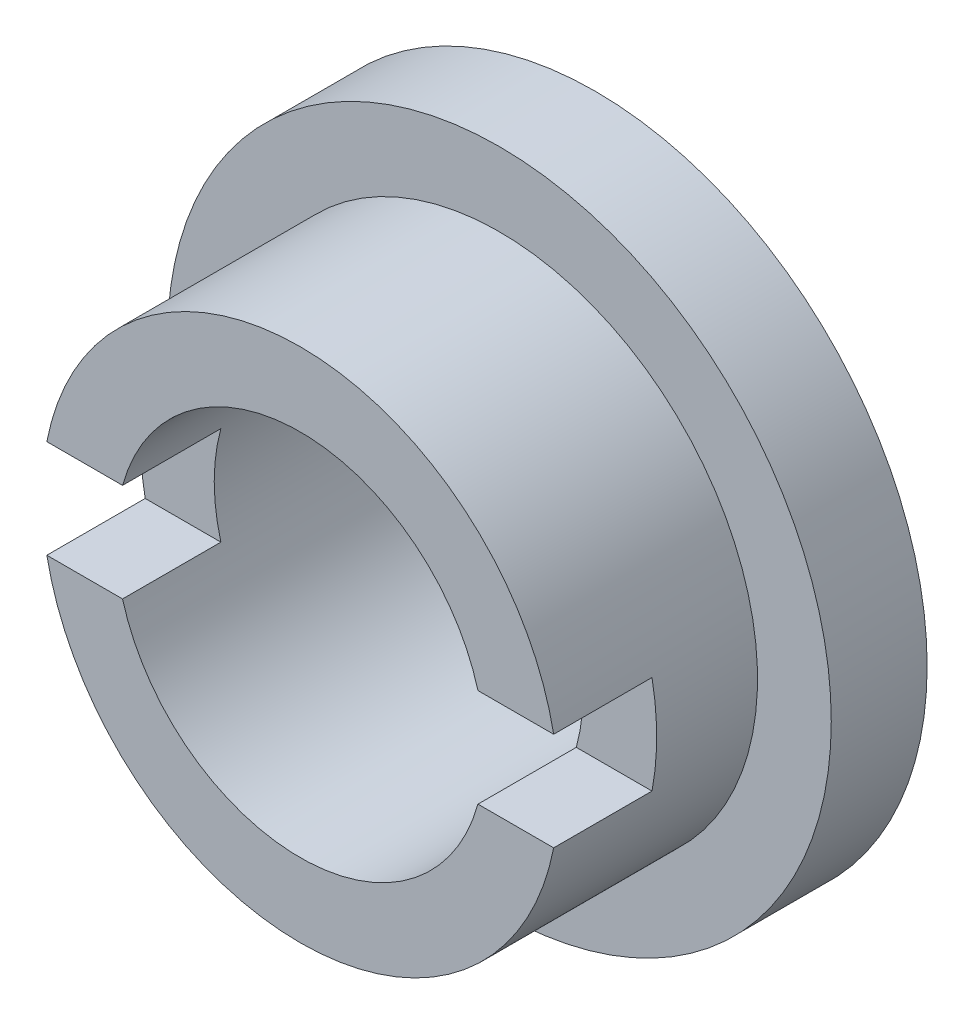
from build123d import *

# Parameters (mm, degrees)
SKETCH_1_R          = 10.5
SKETCH_1_R_2        = 7.5
EXTRUDE_1_DEPTH     = 12
SKETCH_2_R          = 13.5
SKETCH_2_R_2        = 10.5
EXTRUDE_2_DEPTH     = 3.9
SKETCH_3_W          = 25.92950511
SKETCH_3_H          = 4
CUT_EXTRUDE_1_DEPTH = 4


with BuildPart() as part:
    # 草图1 → 拉伸-薄壁1 (new body)
    with BuildSketch(Plane.XY):
        Circle(SKETCH_1_R)
        Circle(SKETCH_1_R_2, mode=Mode.SUBTRACT)
    extrude(amount=EXTRUDE_1_DEPTH)

    # 草图2 → 拉伸-薄壁2 (add)
    with BuildSketch(Plane(origin=(0, 0, 0), x_dir=(-1, 0, 0), z_dir=(0, 0, -1))):
        Circle(SKETCH_2_R)
        Circle(SKETCH_2_R_2, mode=Mode.SUBTRACT)
    extrude(amount=-EXTRUDE_2_DEPTH)

    # 草图3 → 切除-拉伸1 (cut)
    with BuildSketch(Plane.XY.offset(12)):
        Rectangle(SKETCH_3_W, SKETCH_3_H)
    extrude(amount=-CUT_EXTRUDE_1_DEPTH, mode=Mode.SUBTRACT)


solid = part.part
